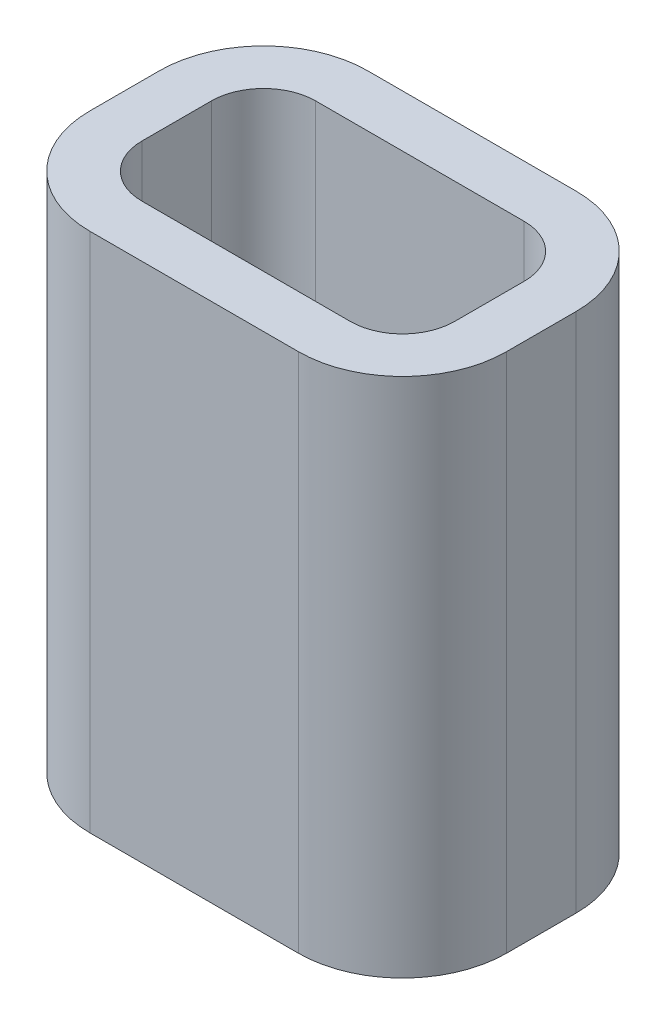
from build123d import *

# Parameters (mm, degrees)
SALIENTE_EXTRUIR1_DEPTH = 30
CROQUIS3_W              = 4.89350096
CROQUIS3_H              = 4.01782184
SALIENTE_EXTRUIR2_DEPTH = 3
SALIENTE_EXTRUIR3_DEPTH = 1


with BuildPart() as part:
    # Croquis1 → Saliente-Extruir1 (new body)
    with BuildSketch(Plane(origin=(0, 0, 0), x_dir=(1, 0, 0), z_dir=(0, 1, 0))):
        with BuildLine():
            Line((-6, 8), (6, 8))
            ThreePointArc((6, 8), (10.242640687, 6.242640687), (12, 2))
            Line((12, 2), (12, -2))
            ThreePointArc((12, -2), (10.242640687, -6.242640687), (6, -8))
            Line((6, -8), (-6, -8))
            ThreePointArc((-6, -8), (-10.242640687, -6.242640687), (-12, -2))
            Line((-12, -2), (-12, 2))
            ThreePointArc((-12, 2), (-10.242640687, 6.242640687), (-6, 8))
        make_face()
        with BuildLine():
            Line((-6, -5), (6, -5))
            ThreePointArc((6, -5), (8.121320344, -4.121320344), (9, -2))
            Line((9, -2), (9, 2))
            ThreePointArc((9, 2), (8.121320344, 4.121320344), (6, 5))
            Line((6, 5), (-6, 5))
            ThreePointArc((-6, 5), (-8.121320344, 4.121320344), (-9, 2))
            Line((-9, 2), (-9, -2))
            ThreePointArc((-9, -2), (-8.121320344, -4.121320344), (-6, -5))
        make_face(mode=Mode.SUBTRACT)
    extrude(amount=SALIENTE_EXTRUIR1_DEPTH)

    # Croquis3 → Saliente-Extruir2 (add)
    with BuildSketch(Plane(origin=(0, 0, -8), x_dir=(-1, 0, 0), z_dir=(0, 0, -1))):
        with Locations((0, 15)):
            Rectangle(CROQUIS3_W, CROQUIS3_H)
    extrude(amount=SALIENTE_EXTRUIR2_DEPTH)

    # Croquis5 → Saliente-Extruir3 (add)
    with BuildSketch(Plane.XZ):
        with BuildLine():
            Line((6, -5), (-6, -5))
            ThreePointArc((-6, -5), (-8.121320344, -4.121320344), (-9, -2))
            Line((-9, -2), (-9, 2))
            ThreePointArc((-9, 2), (-8.121320344, 4.121320344), (-6, 5))
            Line((-6, 5), (6, 5))
            ThreePointArc((6, 5), (8.121320344, 4.121320344), (9, 2))
            Line((9, 2), (9, -2))
            ThreePointArc((9, -2), (8.121320344, -4.121320344), (6, -5))
        make_face()
    extrude(amount=-SALIENTE_EXTRUIR3_DEPTH)


solid = part.part
